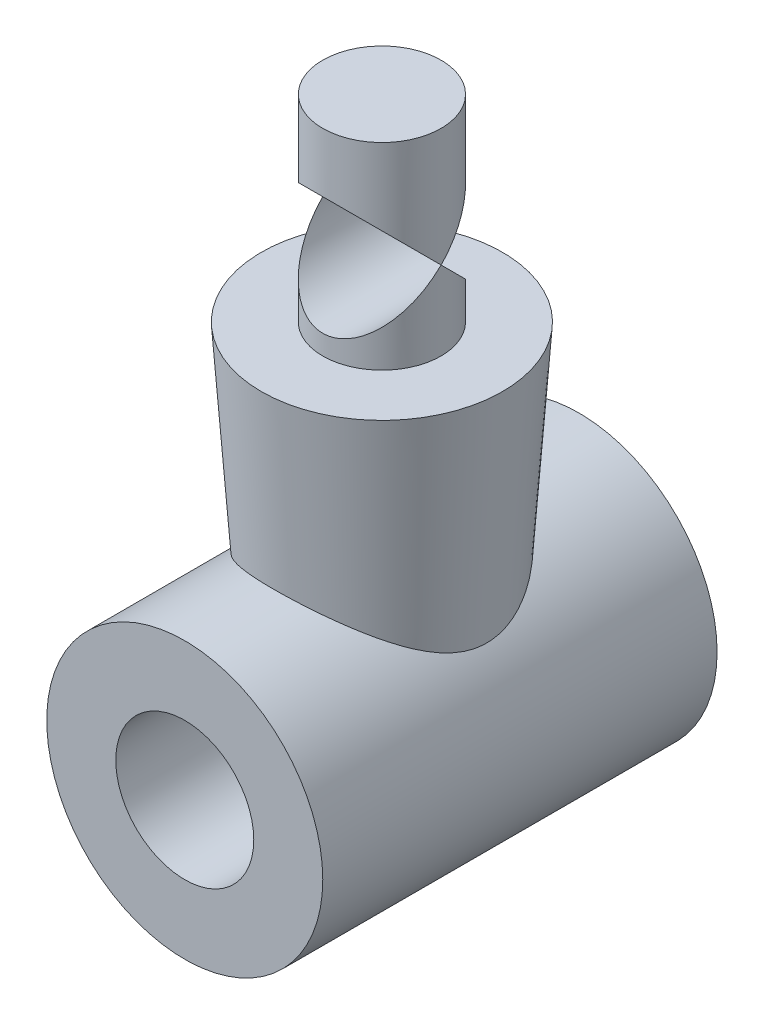
from build123d import *

# Parameters (mm, degrees)
SKETCH1_R           = 35
BOSS_EXTRUDE1_DEPTH = 50
SKETCH2_R           = 25
BOSS_EXTRUDE2_DEPTH = 80
BOSS_EXTRUDE2_DRAFT = -4
SKETCH8_R           = 15
CUT_EXTRUDE5_DEPTH  = 133.759180635
SKETCH7_R           = 15
BOSS_EXTRUDE3_DEPTH = 50
SKETCH4_R           = 17.5
CUT_EXTRUDE2_DEPTH  = 168.705098393
SKETCH6_R           = 15
CUT_EXTRUDE3_DEPTH  = 168.705098393


with BuildPart() as part:
    # Sketch1 → Boss-Extrude1 (new, symmetric)
    with BuildSketch(Plane.XY):
        Circle(SKETCH1_R)
    extrude(amount=BOSS_EXTRUDE1_DEPTH, both=True)


with BuildPart() as boss_extrude2_tool:
    # Sketch2 → Boss-Extrude2 (with draft: the straight prism first)
    with BuildSketch(Plane(origin=(0, 0, 0), x_dir=(1, 0, 0), z_dir=(0, 1, 0))):
        Circle(SKETCH2_R)
    extrude(amount=BOSS_EXTRUDE2_DEPTH)
    # Boss-Extrude2: the draft: its side faces are tilted about the plane it starts from
    boss_extrude2_sides = [boss_extrude2_tool.faces().sort_by_distance(p)[0] for p in [
        (-25, 40, 0),
    ]]
    draft(boss_extrude2_sides, Plane(origin=(0, 0, 0), x_dir=(1, 0, 0), z_dir=(0, 1, 0)), BOSS_EXTRUDE2_DRAFT)


with BuildPart() as part_1:
    add(part.part)

    # Boss-Extrude2: add boss_extrude2_tool
    add(boss_extrude2_tool.part)

    # Sketch8 → Cut-Extrude5 (cut, through all)
    with BuildSketch(Plane(origin=(0, 0, -50), x_dir=(-1, 0, 0), z_dir=(0, 0, -1))):
        Circle(SKETCH8_R)
    extrude(amount=-CUT_EXTRUDE5_DEPTH, mode=Mode.SUBTRACT)

    # Sketch7 → Boss-Extrude3 (add)
    with BuildSketch(Plane(origin=(0, 80, 0), x_dir=(1, 0, 0), z_dir=(0, 1, 0))):
        with Locations(Location((0, 0, 0), (0, 0, 270))):
            Circle(SKETCH7_R)
    extrude(amount=BOSS_EXTRUDE3_DEPTH)

    # Sketch4 → Cut-Extrude2 (cut, through all)
    with BuildSketch(Plane.XY.offset(50)):
        Circle(SKETCH4_R)
    extrude(amount=-CUT_EXTRUDE2_DEPTH, mode=Mode.SUBTRACT)

    # Sketch6 → Cut-Extrude3 (cut, through all)
    with BuildSketch(Plane.XY.offset(50)):
        with Locations((0, 100)):
            Circle(SKETCH6_R)
    extrude(amount=-CUT_EXTRUDE3_DEPTH, mode=Mode.SUBTRACT)


with BuildPart() as cut_extrude3_piece_1:
    # of the separate pieces the step leaves, piece 1, a body of its own (cut_extrude3_pieces)
    add(part_1.part.solids().sort_by_distance((26.591353454, 22.757414648, 0))[0])


with BuildPart() as cut_extrude3_piece_2:
    # of the separate pieces the step leaves, piece 2, a body of its own (cut_extrude3_pieces)
    add(part_1.part.solids().sort_by_distance((0, 115, 15))[0])


solid = Compound([cut_extrude3_piece_1.part, cut_extrude3_piece_2.part])
